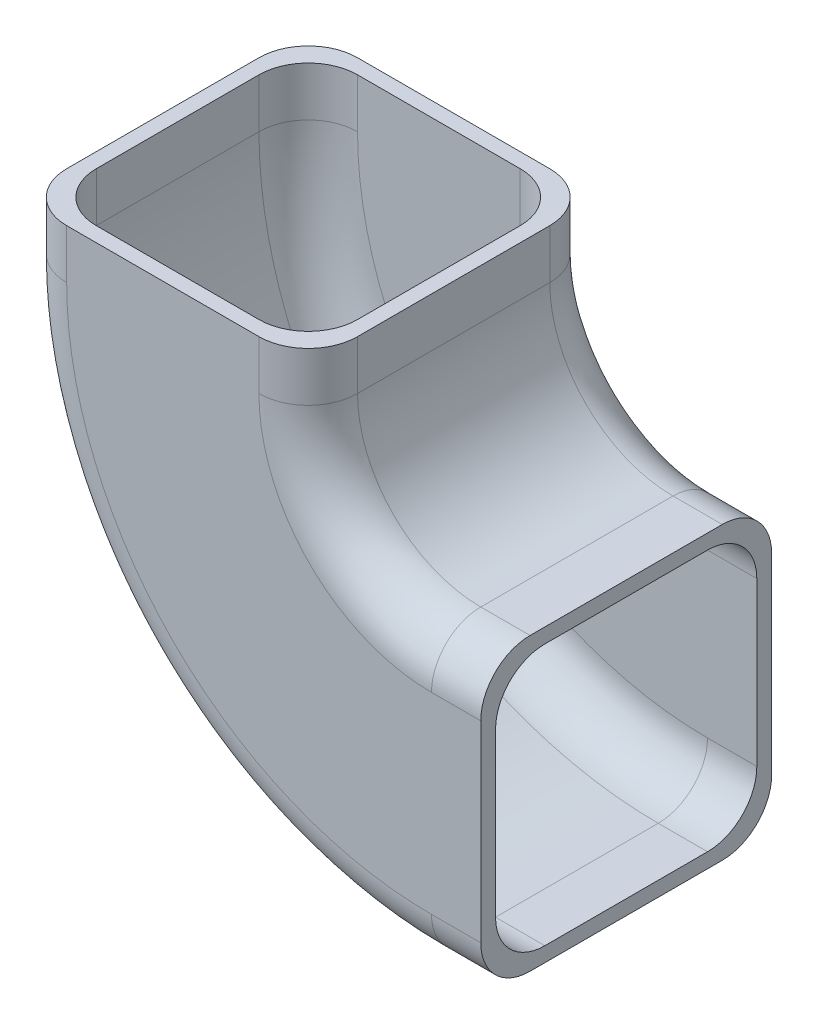
from build123d import *

# Parameters (mm, degrees)
BOSS_EXTRUDE3_DEPTH = 59
SKETCH4_W           = 59
SKETCH4_H           = 59
BOSS_EXTRUDE4_DEPTH = 100
SHELL2_T            = -3
SKETCH5_W           = 59
SKETCH5_H           = 59
CUT_EXTRUDE1_DEPTH  = 100
FILLET1_R           = 10


with BuildPart() as part:
    # Sketch3 → Boss-Extrude3 (new body)
    with BuildSketch(Plane.XY):
        with BuildLine():
            Line((-32.434933876, -26.188574195), (26.565066124, -26.188574195))
            Line((26.565066124, -26.188574195), (26.565066124, -36.188574195))
            ThreePointArc((26.565066124, -36.188574195), (33.887396594, -53.866243725), (51.565066124, -61.188574195))
            Line((51.565066124, -61.188574195), (61.565066124, -61.188574195))
            Line((61.565066124, -61.188574195), (61.565066124, -120.188574195))
            Line((61.565066124, -120.188574195), (51.565066124, -120.188574195))
            ThreePointArc((51.565066124, -120.188574195), (-7.831903496, -95.585543815), (-32.434933876, -36.188574195))
            Line((-32.434933876, -36.188574195), (-32.434933876, -26.188574195))
        make_face()
    extrude(amount=BOSS_EXTRUDE3_DEPTH)

    # Sketch4 → Boss-Extrude4 (add)
    with BuildSketch(Plane(origin=(61.565066124, 0, 0), x_dir=(0, 0, -1), z_dir=(1, 0, 0))):
        with Locations((-29.5, -90.688574195)):
            Rectangle(SKETCH4_W, SKETCH4_H)
    extrude(amount=BOSS_EXTRUDE4_DEPTH)

    # Shell2
    shell2_openings = [part.faces().sort_by_distance(p)[0] for p in [
        (-2.934933876, -26.188574195, 29.5),
    ]]
    offset(amount=SHELL2_T, openings=shell2_openings, kind=Kind.INTERSECTION)

    # Sketch5 → Cut-Extrude1 (cut)
    with BuildSketch(Plane(origin=(161.565066124, 0, 0), x_dir=(0, 0, -1), z_dir=(1, 0, 0))):
        with Locations((-29.5, -90.688574195)):
            Rectangle(SKETCH5_W, SKETCH5_H)
    extrude(amount=-CUT_EXTRUDE1_DEPTH, mode=Mode.SUBTRACT)

    # Fillet1
    fillet1_edges = [part.edges().sort_by_distance(p)[0] for p in [
        (56.565066124, -120.188574195, 0),
        (-7.831903496, -95.585543815, 0),
        (-32.434933876, -31.188574195, 0),
        (56.565066124, -120.188574195, 59),
        (33.887396594, -53.866243725, 59),
        (26.565066124, -31.188574195, 59),
        (-29.434933876, -31.188574195, 3),
        (-5.710583152, -93.464223471, 3),
        (56.565066124, -117.188574195, 3),
        (31.76607625, -55.987564069, 3),
        (23.565066124, -31.188574195, 3),
        (-29.434933876, -31.188574195, 56),
        (-5.710583152, -93.464223471, 56),
        (56.565066124, -117.188574195, 56),
        (31.76607625, -55.987564069, 56),
        (23.565066124, -31.188574195, 56),
        (-32.434933876, -31.188574195, 59),
        (56.565066124, -64.188574195, 3),
        (56.565066124, -64.188574195, 56),
        (56.565066124, -61.188574195, 0),
        (56.565066124, -61.188574195, 59),
        (-7.831903496, -95.585543815, 59),
        (26.565066124, -31.188574195, 0),
        (33.887396594, -53.866243725, 0),
    ]]
    fillet(fillet1_edges, radius=FILLET1_R)


solid = part.part
